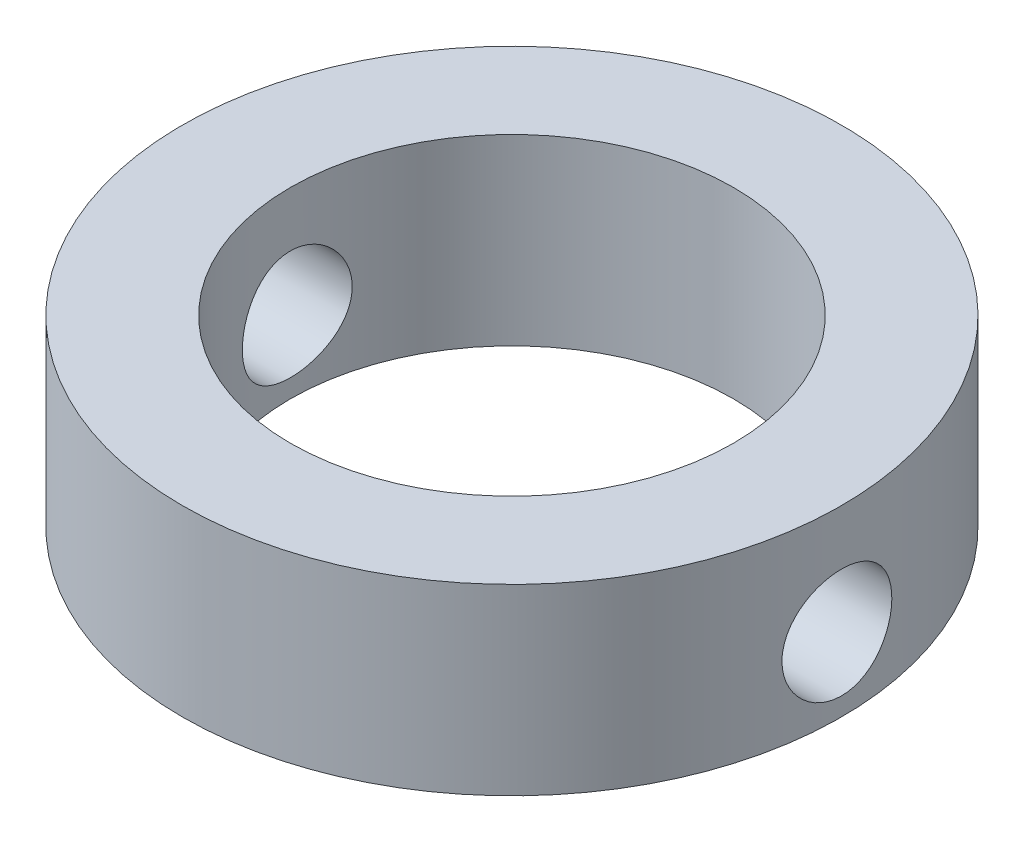
from build123d import *

# Parameters (mm, degrees)
COLLAR_STOCK_SKETCH_R             = 9
COLLAR_STOCK_DEPTH                = 5
AXLE_COLLAR_BORE_SKETCH_R         = 6.05
AXLE_COLLAR_BORE_DEPTH            = 5.2
POSITIVE_SPRING_PIN_BORE_SKETCH_R = 1.5
POSITIVE_SPRING_PIN_BORE_DEPTH    = 20


with BuildPart() as part:
    # Collar stock sketch → Collar stock (new body)
    with BuildSketch(Plane(origin=(0, -215, 0), x_dir=(1, 0, 0), z_dir=(0, 1, 0))):
        with Locations(Location((-19.009182883, 53.244882879, 0), (0, 0, 270))):
            Circle(COLLAR_STOCK_SKETCH_R)
    extrude(amount=COLLAR_STOCK_DEPTH)

    # Axle collar bore sketch → Axle collar bore (cut)
    with BuildSketch(Plane(origin=(0, -215.1, 0), x_dir=(1, 0, 0), z_dir=(0, 1, 0))):
        with Locations(Location((-19.009182883, 53.244882879, 0), (0, 0, 270))):
            Circle(AXLE_COLLAR_BORE_SKETCH_R)
    extrude(amount=AXLE_COLLAR_BORE_DEPTH, mode=Mode.SUBTRACT)

    # Positive spring pin bore sketch → Positive spring pin bore (cut)
    with BuildSketch(Plane(origin=(-29.009182883, 0, 0), x_dir=(0, 0, -1), z_dir=(1, 0, 0))):
        with Locations(Location((53.244882879, -213, 0), (0, 0, 180))):
            Circle(POSITIVE_SPRING_PIN_BORE_SKETCH_R)
    extrude(amount=POSITIVE_SPRING_PIN_BORE_DEPTH, mode=Mode.SUBTRACT)


solid = part.part
